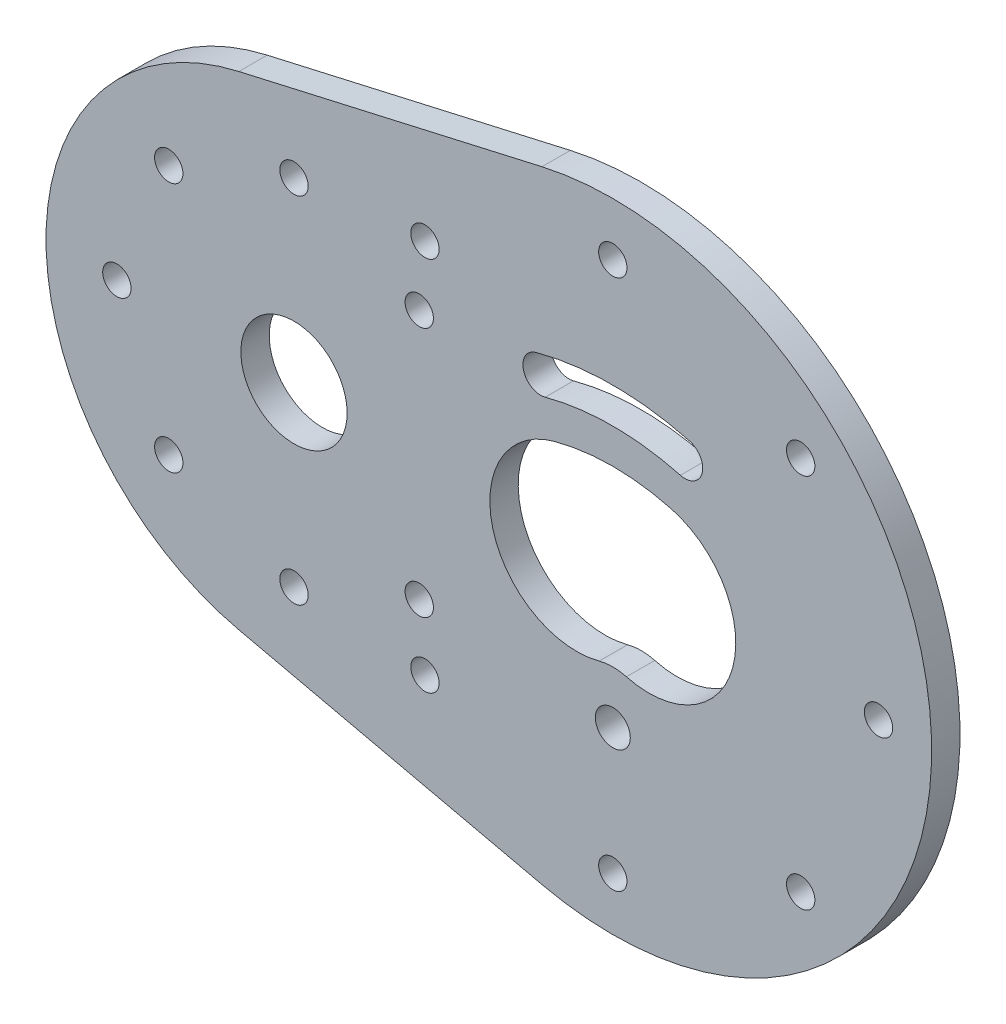
from build123d import *

# Parameters (mm, degrees)
SKETCH1_W           = 127
SKETCH1_H           = 88.9
SKETCH1_R           = 1.564880276
SKETCH1_R_2         = 4.7625
BOSS_EXTRUDE1_DEPTH = 2.54
SKETCH2_W           = 177.519600035
SKETCH2_H           = 126.718171086
CUT_EXTRUDE1_DEPTH  = 108.831991492
SKETCH4_R           = 1.27
CUT_EXTRUDE2_DEPTH  = 66.377727285


with BuildPart() as part:
    # Sketch1 → Boss-Extrude1 (new body)
    with BuildSketch(Plane.XY):
        with Locations((-28.03132955, 12.5)):
            Rectangle(SKETCH1_W, SKETCH1_H)
        Circle(SKETCH1_R, mode=Mode.SUBTRACT)
        with Locations((-28.575, 12.5)):
            Circle(SKETCH1_R_2, mode=Mode.SUBTRACT)
        with BuildLine():
            ThreePointArc((5.250170212, 19.593901979), (10.755067214, 10.059140681), (1.220305916, 4.554243678))
            ThreePointArc((1.220305916, 4.554243678), (0, 4.7149), (-1.220305916, 4.554243678))
            ThreePointArc((-1.220305916, 4.554243678), (-10.755067214, 10.059140681), (-5.250170212, 19.593901979))
            ThreePointArc((-5.250170212, 19.593901979), (0, 20.2851), (5.250170212, 19.593901979))
        make_face(mode=Mode.SUBTRACT)
        with BuildLine():
            ThreePointArc((6.881351362, 25.681552906), (0, 26.5875), (-6.881351362, 25.681552906))
            ThreePointArc((-6.881351362, 25.681552906), (-8.003883377, 23.737270423), (-6.059600893, 22.614738408))
            ThreePointArc((-6.059600893, 22.614738408), (0, 23.4125), (6.059600893, 22.614738408))
            ThreePointArc((6.059600893, 22.614738408), (8.003883377, 23.737270423), (6.881351362, 25.681552906))
        make_face(mode=Mode.SUBTRACT)
    extrude(amount=BOSS_EXTRUDE1_DEPTH)

    # Sketch2 → Cut-Extrude1 (cut, through all)
    with BuildSketch(Plane.XY.offset(2.54)):
        with Locations((-18.257651528, 17.008273159)):
            Rectangle(SKETCH2_W, SKETCH2_H)
        with BuildLine():
            Line((-33.513888889, 34.169287057), (-6.35, 40.36051193))
            ThreePointArc((-6.35, 40.36051193), (28.575, 12.5), (-6.35, -15.36051193))
            Line((-6.35, -15.36051193), (-33.513888889, -9.169287057))
            ThreePointArc((-33.513888889, -9.169287057), (-50.8, 12.5), (-33.513888889, 34.169287057))
        make_face(mode=Mode.SUBTRACT)
    extrude(amount=-CUT_EXTRUDE1_DEPTH, mode=Mode.SUBTRACT)

    # Sketch4 → Cut-Extrude2 (cut, through all)
    with BuildSketch(Plane.XY.offset(2.54)):
        with Locations((-28.575, 28.375)):
            Circle(SKETCH4_R)
        with Locations((0, 36.3125)):
            Circle(SKETCH4_R)
        with Locations((-17.349679849, 23.725320151)):
            Circle(SKETCH4_R)
        with Locations((-17.349679849, 1.274679849)):
            Circle(SKETCH4_R)
        with Locations((-28.575, -3.375)):
            Circle(SKETCH4_R)
        with Locations((-39.800320151, 1.274679849)):
            Circle(SKETCH4_R)
        with Locations((-44.45, 12.5)):
            Circle(SKETCH4_R)
        with Locations((-39.800320151, 23.725320151)):
            Circle(SKETCH4_R)
        with Locations((16.837980227, 29.337980227)):
            Circle(SKETCH4_R)
        with Locations((23.8125, 12.5)):
            Circle(SKETCH4_R)
        with Locations((16.837980227, -4.337980227)):
            Circle(SKETCH4_R)
        with Locations((0, -11.3125)):
            Circle(SKETCH4_R)
        with Locations((-16.837980227, -4.337980227)):
            Circle(SKETCH4_R)
        with Locations((-16.837980227, 29.337980227)):
            Circle(SKETCH4_R)
    extrude(amount=-CUT_EXTRUDE2_DEPTH, mode=Mode.SUBTRACT)


solid = part.part
